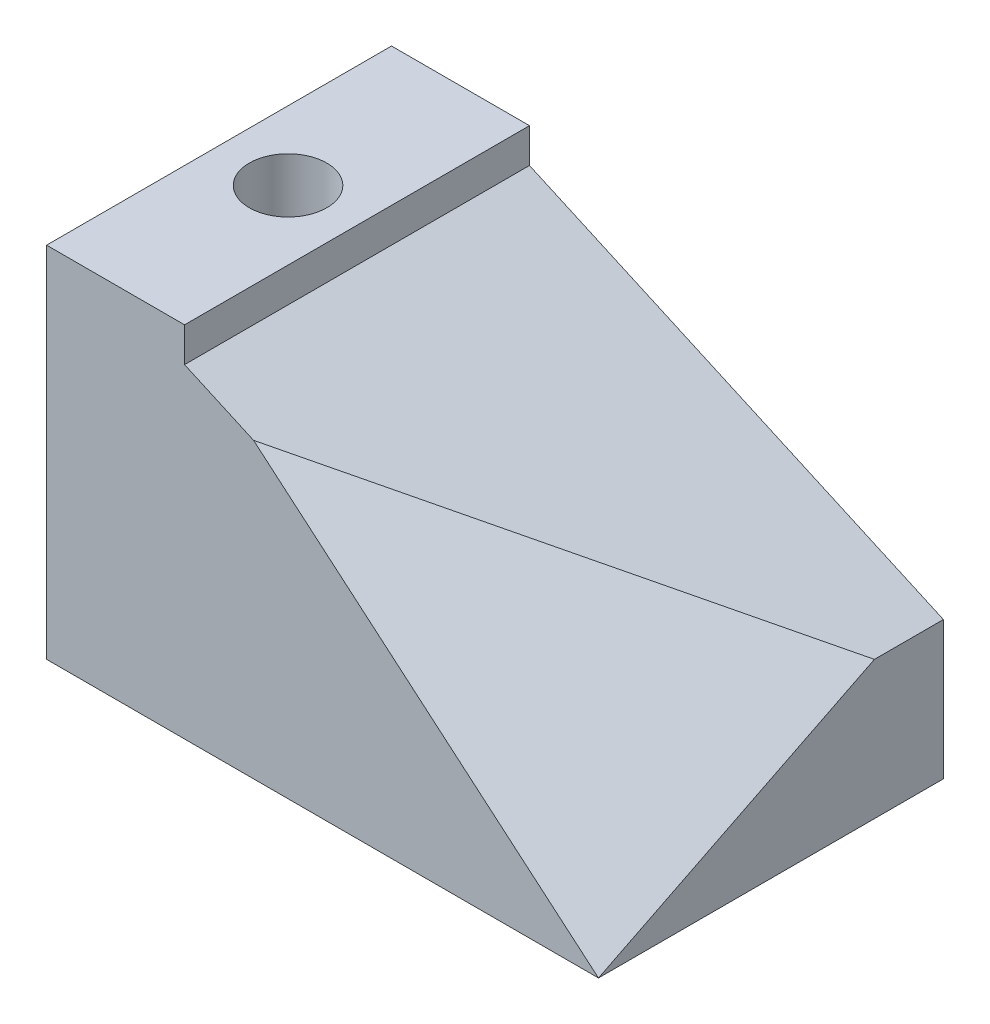
from build123d import *

# Parameters (mm, degrees)
BOSS_EXTRUDE1_DEPTH = 125
CUT_EXTRUDE1_DEPTH  = 250
SKETCH2_R           = 28.1
CUT_EXTRUDE2_DEPTH  = 150


with BuildPart() as part:
    # Sketch1 → Boss-Extrude1 (new, symmetric)
    with BuildSketch(Plane.XY):
        Polygon((0, 0), (0, -260), (400, -260), (400, -160), (100, -25), (100, 0), align=None)
    extrude(amount=BOSS_EXTRUDE1_DEPTH, both=True)

    # 3DSketch1 → Cut-Extrude1 (cut, along a direction that is not the sketch's normal)
    with BuildSketch(Plane(origin=(150, -47.5, 125), x_dir=(0.7367094686837573, -0.3315192609076908, -0.5893675749470058), z_dir=(-0.6052160263325688, -0.7120188545089043, -0.3560094272544522))):
        Polygon((0, 0), (339.346799012, 0), (254.625210114, 206.935382123), align=None)
    extrude(amount=-CUT_EXTRUDE1_DEPTH, dir=(0, -1, 0), mode=Mode.SUBTRACT)

    # Sketch2 → Cut-Extrude2 (cut)
    with BuildSketch(Plane(origin=(0, 0, 0), x_dir=(1, 0, 0), z_dir=(0, 1, 0))):
        with Locations(Location((50, 0, 0), (0, 0, 180))):
            Circle(SKETCH2_R)
    extrude(amount=-CUT_EXTRUDE2_DEPTH, mode=Mode.SUBTRACT)


solid = part.part
